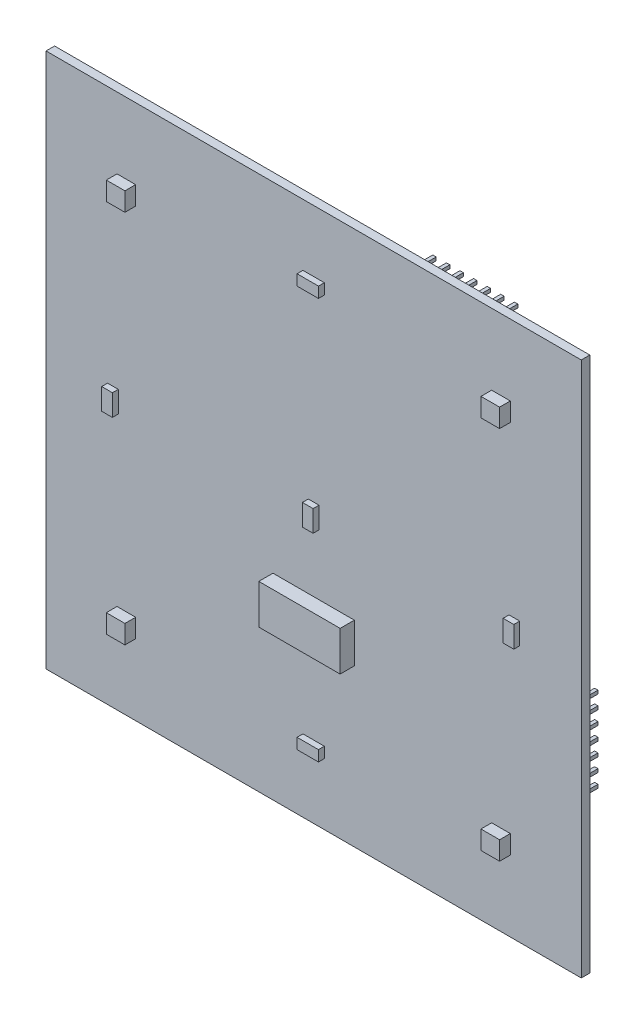
from build123d import *

# Parameters (mm, degrees)
SKETCH_1_W       = 100
SKETCH_1_H       = 100
EXTRUDE_1_DEPTH  = 1.6
SKETCH_4_W       = 17.78
SKETCH_4_H       = 2.5
SKETCH_4_W_2     = 2.5
SKETCH_4_H_2     = 17.78
EXTRUDE_2_DEPTH  = 2.5
SKETCH_5_W       = 0.64
SKETCH_5_H       = 0.64
EXTRUDE_3_DEPTH  = 6.1
SKETCH_6_W       = 3.48
SKETCH_6_H       = 3.48
EXTRUDE_4_DEPTH  = 2
SKETCH_7_W       = 2
SKETCH_7_H       = 4
SKETCH_7_W_2     = 4
SKETCH_7_H_2     = 2
EXTRUDE_5_DEPTH  = 1.1
SKETCH_8_W       = 15.2
SKETCH_8_H       = 7.4
EXTRUDE_6_DEPTH  = 2.65
SKETCH_9_W       = 7.62
SKETCH_9_H       = 2.5
EXTRUDE_7_DEPTH  = 2.5
SKETCH_11_W      = 0.64
SKETCH_11_H      = 0.64
EXTRUDE_8_DEPTH  = 6.1
EXTRUDE_9_DEPTH  = 6
SKETCH_14_R      = 1
SKETCH_14_W      = 7.62
SKETCH_14_H      = 2.5
EXTRUDE_10_DEPTH = 2


with BuildPart() as part:
    # ｽｹｯﾁ1 → ﾎﾞｽ - 押し出し1 (new body)
    with BuildSketch(Plane.XY):
        Rectangle(SKETCH_1_W, SKETCH_1_H)
    extrude(amount=EXTRUDE_1_DEPTH)

    # ｽｹｯﾁ4 → ﾎﾞｽ - 押し出し2 (add)
    with BuildSketch(Plane(origin=(0, 0, 0), x_dir=(-1, 0, 0), z_dir=(0, 0, -1))):
        with Locations((20, -42.6)):
            Rectangle(SKETCH_4_W, SKETCH_4_H)
        with Locations((-42.6, -20)):
            Rectangle(SKETCH_4_W_2, SKETCH_4_H_2)
        with Locations((-20, 42.6)):
            Rectangle(SKETCH_4_W, SKETCH_4_H)
        with Locations((42.6, 20)):
            Rectangle(SKETCH_4_W_2, SKETCH_4_H_2)
    extrude(amount=EXTRUDE_2_DEPTH)

    # ｽｹｯﾁ5 → ﾎﾞｽ - 押し出し3 (add)
    with BuildSketch(Plane(origin=(0, 0, -2.5), x_dir=(-1, 0, 0), z_dir=(0, 0, -1))):
        with Locations((-20, 42.6)):
            Rectangle(SKETCH_5_W, SKETCH_5_H)
        with Locations((-17.46, 42.6)):
            Rectangle(SKETCH_5_W, SKETCH_5_H)
        with Locations((-14.92, 42.6)):
            Rectangle(SKETCH_5_W, SKETCH_5_H)
        with Locations((-12.38, 42.6)):
            Rectangle(SKETCH_5_W, SKETCH_5_H)
        with Locations((-22.54, 42.6)):
            Rectangle(SKETCH_5_W, SKETCH_5_H)
        with Locations((-25.08, 42.6)):
            Rectangle(SKETCH_5_W, SKETCH_5_H)
        with Locations((-27.62, 42.6)):
            Rectangle(SKETCH_5_W, SKETCH_5_H)
        with Locations((-42.6, -20)):
            Rectangle(SKETCH_5_W, SKETCH_5_H)
        with Locations((-42.6, -22.54)):
            Rectangle(SKETCH_5_W, SKETCH_5_H)
        with Locations((42.6, 20)):
            Rectangle(SKETCH_5_W, SKETCH_5_H)
        with Locations((-42.6, -25.08)):
            Rectangle(SKETCH_5_W, SKETCH_5_H)
        with Locations((-42.6, -27.62)):
            Rectangle(SKETCH_5_W, SKETCH_5_H)
        with Locations((-42.6, -17.46)):
            Rectangle(SKETCH_5_W, SKETCH_5_H)
        with Locations((-42.6, -14.92)):
            Rectangle(SKETCH_5_W, SKETCH_5_H)
        with Locations((-42.6, -12.38)):
            Rectangle(SKETCH_5_W, SKETCH_5_H)
        with Locations((42.6, 17.46)):
            Rectangle(SKETCH_5_W, SKETCH_5_H)
        with Locations((42.6, 14.92)):
            Rectangle(SKETCH_5_W, SKETCH_5_H)
        with Locations((42.6, 12.38)):
            Rectangle(SKETCH_5_W, SKETCH_5_H)
        with Locations((42.6, 22.54)):
            Rectangle(SKETCH_5_W, SKETCH_5_H)
        with Locations((42.6, 25.08)):
            Rectangle(SKETCH_5_W, SKETCH_5_H)
        with Locations((42.6, 27.62)):
            Rectangle(SKETCH_5_W, SKETCH_5_H)
        with Locations((20, -42.6)):
            Rectangle(SKETCH_5_W, SKETCH_5_H)
        with Locations((17.46, -42.6)):
            Rectangle(SKETCH_5_W, SKETCH_5_H)
        with Locations((14.92, -42.6)):
            Rectangle(SKETCH_5_W, SKETCH_5_H)
        with Locations((12.38, -42.6)):
            Rectangle(SKETCH_5_W, SKETCH_5_H)
        with Locations((22.54, -42.6)):
            Rectangle(SKETCH_5_W, SKETCH_5_H)
        with Locations((25.08, -42.6)):
            Rectangle(SKETCH_5_W, SKETCH_5_H)
        with Locations((27.62, -42.6)):
            Rectangle(SKETCH_5_W, SKETCH_5_H)
    extrude(amount=EXTRUDE_3_DEPTH)

    # ｽｹｯﾁ6 → ﾎﾞｽ - 押し出し4 (add)
    with BuildSketch(Plane.XY.offset(1.6)):
        with Locations((-35, -35)):
            Rectangle(SKETCH_6_W, SKETCH_6_H)
        with Locations((-35, 35)):
            Rectangle(SKETCH_6_W, SKETCH_6_H)
        with Locations((35, -35)):
            Rectangle(SKETCH_6_W, SKETCH_6_H)
        with Locations((35, 35)):
            Rectangle(SKETCH_6_W, SKETCH_6_H)
    extrude(amount=EXTRUDE_4_DEPTH)

    # ｽｹｯﾁ7 → ﾎﾞｽ - 押し出し5 (add)
    with BuildSketch(Plane.XY.offset(1.6)):
        with Locations((-37.5, 0)):
            Rectangle(SKETCH_7_W, SKETCH_7_H)
        with Locations((37.5, 0)):
            Rectangle(SKETCH_7_W, SKETCH_7_H)
        with Locations((0, 37.5)):
            Rectangle(SKETCH_7_W_2, SKETCH_7_H_2)
        with Locations((0, -37.5)):
            Rectangle(SKETCH_7_W_2, SKETCH_7_H_2)
        Rectangle(SKETCH_7_W, SKETCH_7_H)
    extrude(amount=EXTRUDE_5_DEPTH)

    # ｽｹｯﾁ8 → ﾎﾞｽ - 押し出し6 (add)
    with BuildSketch(Plane.XY.offset(1.6)):
        with Locations((0, -17)):
            Rectangle(SKETCH_8_W, SKETCH_8_H)
    extrude(amount=EXTRUDE_6_DEPTH)

    # ｽｹｯﾁ9 → ﾎﾞｽ - 押し出し7 (add)
    with BuildSketch(Plane(origin=(0, 0, 0), x_dir=(-1, 0, 0), z_dir=(0, 0, -1))):
        with Locations((-0.8, 18.58)):
            Rectangle(SKETCH_9_W, SKETCH_9_H)
    extrude(amount=EXTRUDE_7_DEPTH)

    # ｽｹｯﾁ11 → ﾎﾞｽ - 押し出し8 (add)
    with BuildSketch(Plane(origin=(0, 0, -2.5), x_dir=(-1, 0, 0), z_dir=(0, 0, -1))):
        with Locations((-0.8, 18.58)):
            Rectangle(SKETCH_11_W, SKETCH_11_H)
        with Locations((-3.34, 18.58)):
            Rectangle(SKETCH_11_W, SKETCH_11_H)
        with Locations((1.74, 18.58)):
            Rectangle(SKETCH_11_W, SKETCH_11_H)
    extrude(amount=EXTRUDE_8_DEPTH)

    # ｽｹｯﾁ13 → ﾎﾞｽ - 押し出し9 (add)
    with BuildSketch(Plane(origin=(0, 0, 0), x_dir=(-1, 0, 0), z_dir=(0, 0, -1))):
        Polygon((32, -30), (31, -28.267949192), (29, -28.267949192), (28, -30), (29, -31.732050808), (31, -31.732050808), align=None)
        Polygon((-28, -30), (-29, -28.267949192), (-31, -28.267949192), (-32, -30), (-31, -31.732050808), (-29, -31.732050808), align=None)
        Polygon((32, 30), (31, 31.732050808), (29, 31.732050808), (28, 30), (29, 28.267949192), (31, 28.267949192), align=None)
        Polygon((-28, 30), (-29, 31.732050808), (-31, 31.732050808), (-32, 30), (-31, 28.267949192), (-29, 28.267949192), align=None)
    extrude(amount=EXTRUDE_9_DEPTH)


with BuildPart() as body_2:
    # ｽｹｯﾁ14 → ﾎﾞｽ - 押し出し10 (new body)
    with BuildSketch(Plane(origin=(0, 0, -6), x_dir=(-1, 0, 0), z_dir=(0, 0, -1))):
        Polygon((0, -39), (0, -41), (39, -41), (39, 0), (41, 0), (41, 39), (0, 39), (0, 41), (-39, 41), (-39, 0), (-41, 0), (-41, -39), align=None)
        with Locations((-30, 30)):
            Circle(SKETCH_14_R, mode=Mode.SUBTRACT)
        with Locations((30, 30)):
            Circle(SKETCH_14_R, mode=Mode.SUBTRACT)
        with Locations((30, -30)):
            Circle(SKETCH_14_R, mode=Mode.SUBTRACT)
        with Locations((-30, -30)):
            Circle(SKETCH_14_R, mode=Mode.SUBTRACT)
        with Locations((-0.8, 18.58)):
            Rectangle(SKETCH_14_W, SKETCH_14_H, mode=Mode.SUBTRACT)
    extrude(amount=EXTRUDE_10_DEPTH)


solid = Compound([part.part, body_2.part])
